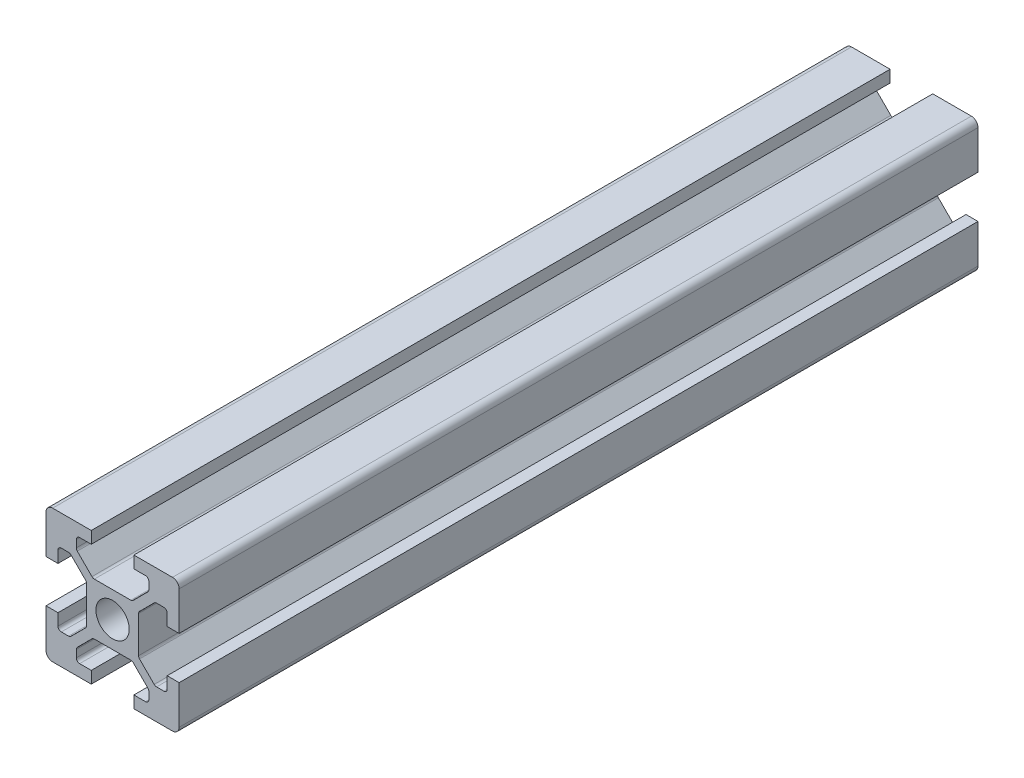
from build123d import *

# Parameters (mm, degrees)
SKETCH1_R           = 2.5
BOSS_EXTRUDE1_DEPTH = 120
FILLET1_R           = 1
FILLET2_R           = 0.5
FILLET3_R           = 0.5
FILLET4_R           = 0.5
FILLET5_R           = 0.5


with BuildPart() as part:
    # Sketch1 → Boss-Extrude1 (new body)
    with BuildSketch(Plane.XY):
        Polygon((13.2, 0), (13.2, 1.8), (15.45, 1.8), (15.45, 3.6), (12.95, 6.1), (7.05, 6.1), (4.55, 3.6), (4.55, 1.8), (6.8, 1.8), (6.8, 0), (0, 0), (0, 6.8), (1.8, 6.8), (1.8, 4.55), (3.6, 4.55), (6.1, 7.05), (6.1, 12.95), (3.6, 15.45), (1.8, 15.45), (1.8, 13.2), (0, 13.2), (0, 20), (6.8, 20), (6.8, 18.2), (4.55, 18.2), (4.55, 16.4), (7.05, 13.9), (12.95, 13.9), (15.45, 16.4), (15.45, 18.2), (13.2, 18.2), (13.2, 20), (20, 20), (20, 13.2), (18.2, 13.2), (18.2, 15.45), (16.4, 15.45), (13.9, 12.95), (13.9, 7.05), (16.4, 4.55), (18.2, 4.55), (18.2, 6.8), (20, 6.8), (20, 0), align=None)
        with Locations((10, 10)):
            Circle(SKETCH1_R, mode=Mode.SUBTRACT)
    extrude(amount=BOSS_EXTRUDE1_DEPTH)

    # Fillet1
    fillet1_edges = [part.edges().sort_by_distance(p)[0] for p in [
        (0, 0, 60),
        (0, 20, 60),
        (20, 20, 60),
        (20, 0, 60),
    ]]
    fillet(fillet1_edges, radius=FILLET1_R)

    # Fillet2
    fillet2_edges = [part.edges().sort_by_distance(p)[0] for p in [
        (4.55, 18.2, 60),
        (4.55, 16.4, 60),
        (7.05, 13.9, 60),
        (12.95, 13.9, 60),
        (15.45, 16.4, 60),
        (15.45, 18.2, 60),
    ]]
    fillet(fillet2_edges, radius=FILLET2_R)

    # Fillet3
    fillet3_edges = [part.edges().sort_by_distance(p)[0] for p in [
        (18.2, 15.45, 60),
        (16.4, 15.45, 60),
        (13.9, 12.95, 60),
        (13.9, 7.05, 60),
        (16.4, 4.55, 60),
        (18.2, 4.55, 60),
    ]]
    fillet(fillet3_edges, radius=FILLET3_R)

    # Fillet4
    fillet4_edges = [part.edges().sort_by_distance(p)[0] for p in [
        (1.8, 4.55, 60),
        (3.6, 4.55, 60),
        (6.1, 7.05, 60),
        (6.1, 12.95, 60),
        (3.6, 15.45, 60),
        (1.8, 15.45, 60),
    ]]
    fillet(fillet4_edges, radius=FILLET4_R)

    # Fillet5
    fillet5_edges = [part.edges().sort_by_distance(p)[0] for p in [
        (15.45, 1.8, 60),
        (15.45, 3.6, 60),
        (12.95, 6.1, 60),
        (7.05, 6.1, 60),
        (4.55, 3.6, 60),
        (4.55, 1.8, 60),
    ]]
    fillet(fillet5_edges, radius=FILLET5_R)


solid = part.part
